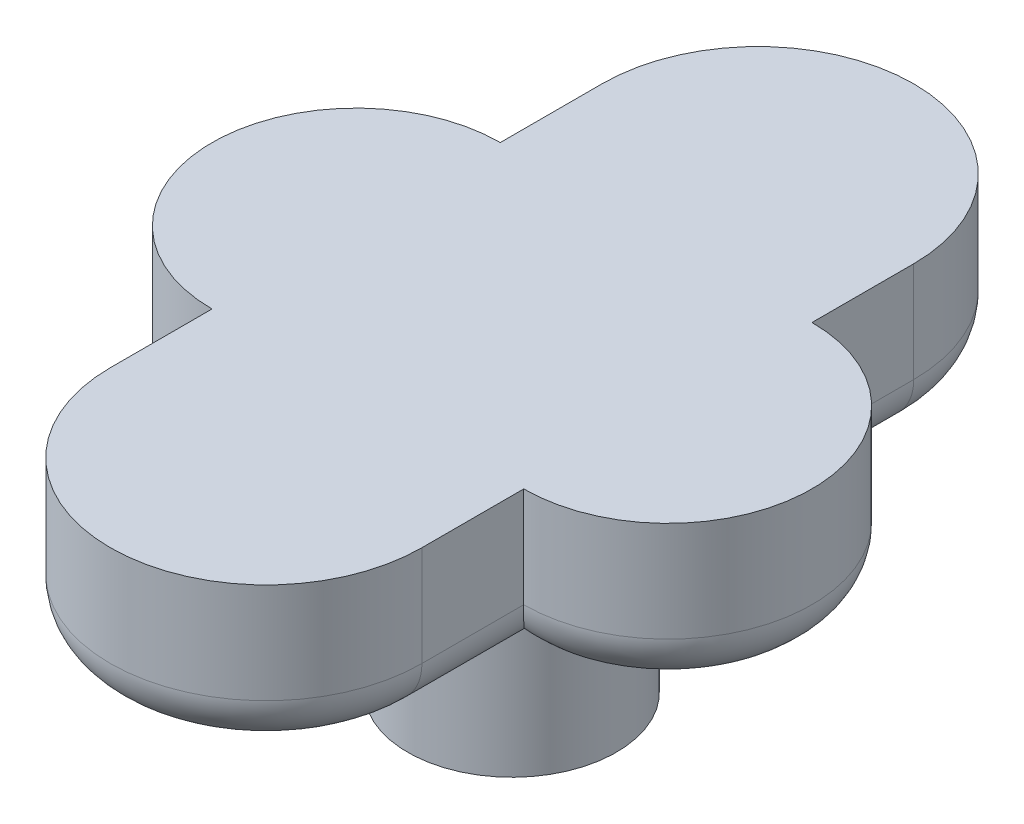
from build123d import *

# Parameters (mm, degrees)
SALIENTE_EXTRUIR1_DEPTH = 30
CROQUIS3_R              = 20.8
CROQUIS3_R_2            = 10.8
SALIENTE_EXTRUIR2_DEPTH = 35
REDONDEO1_R             = 5
REDONDEO4_R             = 10


with BuildPart() as part:
    # Croquis2 → Saliente-Extruir1 (new body)
    with BuildSketch(Plane(origin=(0, 0, 0), x_dir=(1, 0, 0), z_dir=(0, 1, 0))):
        with BuildLine():
            Line((35.131604566, 18.926463751), (35.131604566, 39.218716838))
            ThreePointArc((35.131604566, 39.218716838), (66.20576122, 70.292873492), (97.279917874, 39.218716838))
            Line((97.279917874, 39.218716838), (97.279917874, 18.926463751))
            ThreePointArc((97.279917874, 18.926463751), (126.019675086, -9.813293461), (97.279917874, -38.553050674))
            Line((97.279917874, -38.553050674), (97.279917874, -58.84530376))
            ThreePointArc((97.279917874, -58.84530376), (66.20576122, -89.919460414), (35.131604566, -58.84530376))
            Line((35.131604566, -58.84530376), (35.131604566, -38.553050674))
            ThreePointArc((35.131604566, -38.553050674), (6.391847353, -9.813293461), (35.131604566, 18.926463751))
        make_face()
    extrude(amount=SALIENTE_EXTRUIR1_DEPTH)

    # Croquis3 → Saliente-Extruir2 (add)
    with BuildSketch(Plane.XZ):
        with Locations(Location((66.20576122, 9.813293461, 0), (0, 0, 270))):
            Circle(CROQUIS3_R)
        with Locations(Location((66.20576122, 9.813293461, 0), (0, 0, 270))):
            Circle(CROQUIS3_R_2, mode=Mode.SUBTRACT)
    extrude(amount=SALIENTE_EXTRUIR2_DEPTH)

    # Redondeo1
    redondeo1_edges = [part.edges().sort_by_distance(p)[0] for p in [
        (66.20576122, 0, 30.613293461),
    ]]
    fillet(redondeo1_edges, radius=REDONDEO1_R)

    # Redondeo4
    redondeo4_edges = [part.edges().sort_by_distance(p)[0] for p in [
        (35.131604566, 0, 48.699177217),
        (6.391847353, 0, 9.813293461),
        (35.131604566, 0, -29.072590294),
        (66.20576122, 0, -70.292873492),
        (97.279917874, 0, -29.072590294),
        (126.019675086, 0, 9.813293461),
        (97.279917874, 0, 48.699177217),
        (66.20576122, 0, 89.919460414),
    ]]
    fillet(redondeo4_edges, radius=REDONDEO4_R)


solid = part.part
